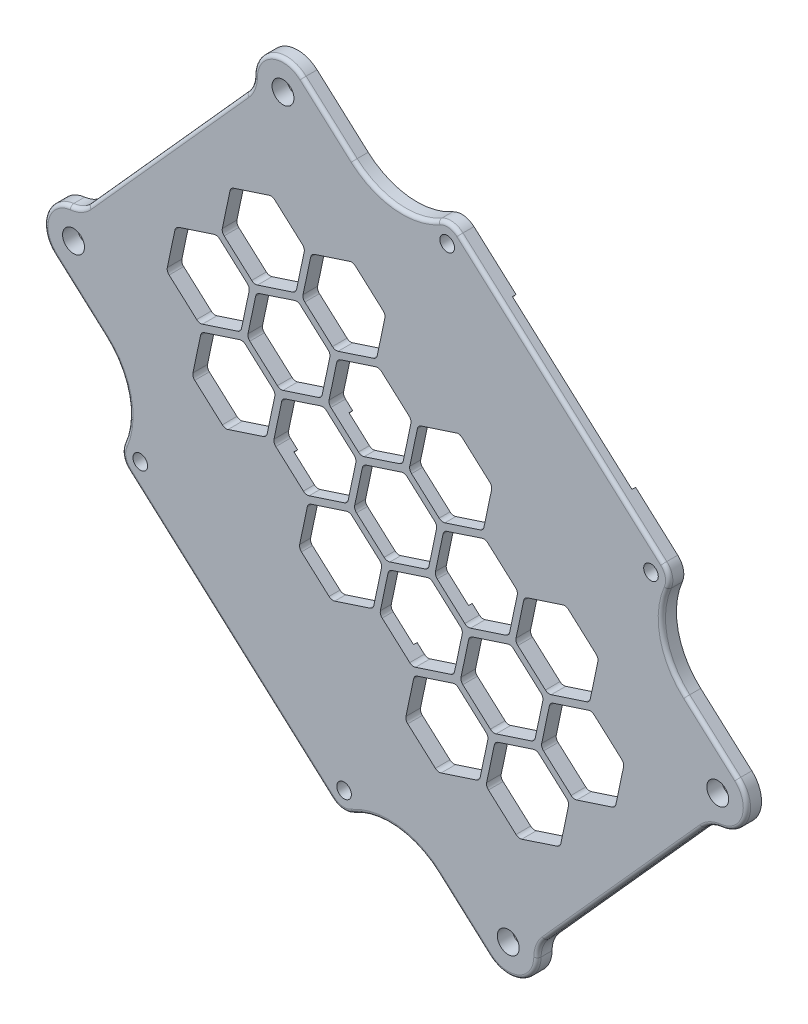
from build123d import *

# Parameters (mm, degrees)
SKETCH_1_R               = 1.5
SKETCH_1_R_2             = 1
EXTRUDE_1_DEPTH          = 2
CUT_EXTRUDE_1_DEPTH      = 170.147960134
CUT_EXTRUDE_1_DEPTH_BACK = 170.147960134
CUT_EXTRUDE_2_DEPTH      = 0.5
FILLET_1_R               = 0.5


with BuildPart() as part:
    # 草图1 → 凸台-拉伸1 (new body)
    with BuildSketch(Plane.XY):
        with BuildLine():
            Line((104.1666858, -4.873863482), (132.089438277, -29.905241673))
            ThreePointArc((132.089438277, -29.905241673), (132.861827092, -31.227500162), (132.718316168, -32.75208424))
            ThreePointArc((132.718316168, -32.75208424), (132.14427247, -38.850420549), (135.233827732, -44.139454506))
            Line((135.233827732, -44.139454506), (142.238552291, -50.418846543))
            ThreePointArc((142.238552291, -50.418846543), (143.562589272, -53.179192368), (142.546965548, -56.067287147))
            ThreePointArc((142.546965548, -56.067287147), (141.410609511, -56.94787551), (140.036310771, -57.369827968))
            ThreePointArc((140.036310771, -57.369827968), (138.66201203, -57.791780426), (137.525655994, -58.672368789))
            Line((137.525655994, -58.672368789), (115.887201179, -82.810281338))
            ThreePointArc((115.887201179, -82.810281338), (115.135572441, -84.035758856), (114.865759868, -85.447828996))
            ThreePointArc((114.865759868, -85.447828996), (114.595947294, -86.859899136), (113.844318556, -88.085376654))
            ThreePointArc((113.844318556, -88.085376654), (111.083972731, -89.409413635), (108.195877951, -88.393789911))
            Line((108.195877951, -88.393789911), (101.191153392, -82.114397874))
            ThreePointArc((101.191153392, -82.114397874), (95.597176576, -79.619071186), (89.597595338, -80.853679173))
            ThreePointArc((89.597595338, -80.853679173), (88.097700029, -81.16233117), (86.699205825, -80.538499498))
            Line((86.699205825, -80.538499498), (58.776453348, -55.507121307))
            ThreePointArc((58.776453348, -55.507121307), (58.004064533, -54.184862818), (58.147575457, -52.66027874))
            ThreePointArc((58.147575457, -52.66027874), (58.721619155, -46.561942431), (55.632063893, -41.272908475))
            Line((55.632063893, -41.272908475), (48.627339334, -34.993516437))
            ThreePointArc((48.627339334, -34.993516437), (47.303302353, -32.233170612), (48.318926077, -29.345075833))
            ThreePointArc((48.318926077, -29.345075833), (49.455282114, -28.46448747), (50.829580854, -28.042535012))
            ThreePointArc((50.829580854, -28.042535012), (52.203879595, -27.620582554), (53.340235631, -26.739994191))
            Line((53.340235631, -26.739994191), (74.978690446, -2.602081642))
            ThreePointArc((74.978690446, -2.602081642), (75.730319184, -1.376604124), (76.000131757, 0.035466016))
            ThreePointArc((76.000131757, 0.035466016), (76.269944331, 1.447536156), (77.021573069, 2.673013674))
            ThreePointArc((77.021573069, 2.673013674), (79.781918894, 3.997050655), (82.670013674, 2.981426931))
            Line((82.670013674, 2.981426931), (89.674738233, -3.297965106))
            ThreePointArc((89.674738233, -3.297965106), (95.268715049, -5.793291794), (101.268296287, -4.558683807))
            ThreePointArc((101.268296287, -4.558683807), (102.768191596, -4.25003181), (104.1666858, -4.873863482))
        make_face()
        with Locations((139.568538617, -53.397273473)):
            Circle(SKETCH_1_R, mode=Mode.SUBTRACT)
        with Locations((110.865891625, -85.41536298)):
            Circle(SKETCH_1_R, mode=Mode.SUBTRACT)
        with Locations((51.297353008, -32.015089507)):
            Circle(SKETCH_1_R, mode=Mode.SUBTRACT)
        with Locations((80, 0.003)):
            Circle(SKETCH_1_R, mode=Mode.SUBTRACT)
        with Locations((102.497927254, -6.735380314)):
            Circle(SKETCH_1_R_2, mode=Mode.SUBTRACT)
        with Locations((130.420679731, -31.766758505)):
            Circle(SKETCH_1_R_2, mode=Mode.SUBTRACT)
        with Locations((88.367964371, -78.676982666)):
            Circle(SKETCH_1_R_2, mode=Mode.SUBTRACT)
        with Locations((60.445211894, -53.645604475)):
            Circle(SKETCH_1_R_2, mode=Mode.SUBTRACT)
    extrude(amount=EXTRUDE_1_DEPTH)

    # 草图2 → 切除-拉伸1 (cut, two sides: drawn at the far end of the back side and taken through both)
    with BuildSketch(Plane.XY.offset(2).offset(-CUT_EXTRUDE_1_DEPTH_BACK)):
        with BuildLine():
            Line((99.995628017, -46.259205996), (101.040173707, -41.291597672))
            ThreePointArc((101.040173707, -41.291597672), (101.01759629, -40.878103121), (100.791296397, -40.531295044))
            Line((100.791296397, -40.531295044), (97.011494237, -37.142887779))
            ThreePointArc((97.011494237, -37.142887779), (96.642108743, -36.955693121), (96.228614193, -36.978270538))
            Line((96.228614193, -36.978270538), (91.404266343, -38.557471598))
            ThreePointArc((91.404266343, -38.557471598), (91.057458266, -38.78377149), (90.870263608, -39.153156984))
            Line((90.870263608, -39.153156984), (89.825717918, -44.120765309))
            ThreePointArc((89.825717918, -44.120765309), (89.848295335, -44.534259859), (90.074595228, -44.881067936))
            Line((90.074595228, -44.881067936), (93.854397388, -48.269475201))
            ThreePointArc((93.854397388, -48.269475201), (94.223782882, -48.456669859), (94.637277432, -48.434092442))
            Line((94.637277432, -48.434092442), (99.461625282, -46.854891382))
            ThreePointArc((99.461625282, -46.854891382), (99.808433359, -46.62859149), (99.995628017, -46.259205996))
        make_face()
        with BuildLine():
            Line((99.744006193, -47.717545146), (94.919658342, -49.296746205))
            ThreePointArc((94.919658342, -49.296746205), (94.572850266, -49.523046097), (94.385655608, -49.892431591))
            Line((94.385655608, -49.892431591), (93.341109918, -54.860039916))
            ThreePointArc((93.341109918, -54.860039916), (93.363687335, -55.273534466), (93.589987227, -55.620342543))
            Line((93.589987227, -55.620342543), (97.369789388, -59.008749808))
            ThreePointArc((97.369789388, -59.008749808), (97.739174881, -59.195944466), (98.152669432, -59.173367049))
            Line((98.152669432, -59.173367049), (102.977017282, -57.594165989))
            ThreePointArc((102.977017282, -57.594165989), (103.323825359, -57.367866097), (103.511020017, -56.998480603))
            Line((103.511020017, -56.998480603), (104.555565707, -52.030872279))
            ThreePointArc((104.555565707, -52.030872279), (104.532988289, -51.617377728), (104.306688397, -51.270569652))
            Line((104.306688397, -51.270569652), (100.526886237, -47.882162386))
            ThreePointArc((100.526886237, -47.882162386), (100.157500743, -47.694967728), (99.744006193, -47.717545146))
        make_face()
        with BuildLine():
            Line((101.132775856, -47.206286463), (104.912578016, -50.594693728))
            ThreePointArc((104.912578016, -50.594693728), (105.28196351, -50.781888387), (105.69545806, -50.759310969))
            Line((105.69545806, -50.759310969), (110.51980591, -49.18010991))
            ThreePointArc((110.51980591, -49.18010991), (110.866613987, -48.953810017), (111.053808645, -48.584424524))
            Line((111.053808645, -48.584424524), (112.098354335, -43.616816199))
            ThreePointArc((112.098354335, -43.616816199), (112.075776918, -43.203321648), (111.849477025, -42.856513572))
            Line((111.849477025, -42.856513572), (108.069674865, -39.468106307))
            ThreePointArc((108.069674865, -39.468106307), (107.700289371, -39.280911649), (107.286794821, -39.303489066))
            Line((107.286794821, -39.303489066), (102.462446971, -40.882690125))
            ThreePointArc((102.462446971, -40.882690125), (102.115638894, -41.108990018), (101.928444236, -41.478375511))
            Line((101.928444236, -41.478375511), (100.883898546, -46.445983836))
            ThreePointArc((100.883898546, -46.445983836), (100.906475963, -46.859478387), (101.132775856, -47.206286463))
        make_face()
        with BuildLine():
            Line((116.74570464, -53.134996247), (121.57005249, -51.555795187))
            ThreePointArc((121.57005249, -51.555795187), (121.916860566, -51.329495295), (122.104055225, -50.960109801))
            Line((122.104055225, -50.960109801), (123.148600915, -45.992501477))
            ThreePointArc((123.148600915, -45.992501477), (123.126023497, -45.579006926), (122.899723605, -45.232198849))
            Line((122.899723605, -45.232198849), (119.119921445, -41.843791584))
            ThreePointArc((119.119921445, -41.843791584), (118.750535951, -41.656596926), (118.3370414, -41.679174343))
            Line((118.3370414, -41.679174343), (113.51269355, -43.258375403))
            ThreePointArc((113.51269355, -43.258375403), (113.165885474, -43.484675295), (112.978690815, -43.854060789))
            Line((112.978690815, -43.854060789), (111.934145125, -48.821669114))
            ThreePointArc((111.934145125, -48.821669114), (111.956722543, -49.235163664), (112.183022435, -49.581971741))
            Line((112.183022435, -49.581971741), (115.962824595, -52.970379006))
            ThreePointArc((115.962824595, -52.970379006), (116.332210089, -53.157573664), (116.74570464, -53.134996247))
        make_face()
        with BuildLine():
            Line((102.18006606, -40.020036362), (107.00441391, -38.440835303))
            ThreePointArc((107.00441391, -38.440835303), (107.351221987, -38.21453541), (107.538416645, -37.845149916))
            Line((107.538416645, -37.845149916), (108.582962335, -32.877541592))
            ThreePointArc((108.582962335, -32.877541592), (108.560384918, -32.464047041), (108.334085025, -32.117238965))
            Line((108.334085025, -32.117238965), (104.554282865, -28.7288317))
            ThreePointArc((104.554282865, -28.7288317), (104.184897371, -28.541637041), (103.771402821, -28.564214459))
            Line((103.771402821, -28.564214459), (98.947054971, -30.143415518))
            ThreePointArc((98.947054971, -30.143415518), (98.600246894, -30.36971541), (98.413052236, -30.739100904))
            Line((98.413052236, -30.739100904), (97.368506546, -35.706709229))
            ThreePointArc((97.368506546, -35.706709229), (97.391083963, -36.120203779), (97.617383856, -36.467011856))
            Line((97.617383856, -36.467011856), (101.397186016, -39.855419121))
            ThreePointArc((101.397186016, -39.855419121), (101.76657151, -40.042613779), (102.18006606, -40.020036362))
        make_face()
        with BuildLine():
            Line((93.248507769, -48.945351124), (89.468705609, -45.556943859))
            ThreePointArc((89.468705609, -45.556943859), (89.099320115, -45.369749201), (88.685825565, -45.392326618))
            Line((88.685825565, -45.392326618), (83.861477714, -46.971527677))
            ThreePointArc((83.861477714, -46.971527677), (83.514669638, -47.19782757), (83.32747498, -47.567213064))
            Line((83.32747498, -47.567213064), (82.28292929, -52.534821388))
            ThreePointArc((82.28292929, -52.534821388), (82.305506707, -52.948315939), (82.5318066, -53.295124015))
            Line((82.5318066, -53.295124015), (86.31160876, -56.68353128))
            ThreePointArc((86.31160876, -56.68353128), (86.680994254, -56.870725939), (87.094488804, -56.848148521))
            Line((87.094488804, -56.848148521), (91.918836654, -55.268947462))
            ThreePointArc((91.918836654, -55.268947462), (92.265644731, -55.04264757), (92.452839389, -54.673262076))
            Line((92.452839389, -54.673262076), (93.497385079, -49.705653751))
            ThreePointArc((93.497385079, -49.705653751), (93.474807662, -49.292159201), (93.248507769, -48.945351124))
        make_face()
        with BuildLine():
            Line((115.698414435, -60.321246348), (119.478216595, -63.709653613))
            ThreePointArc((119.478216595, -63.709653613), (119.847602089, -63.896848271), (120.26109664, -63.874270854))
            Line((120.26109664, -63.874270854), (125.08544449, -62.295069794))
            ThreePointArc((125.08544449, -62.295069794), (125.432252566, -62.068769902), (125.619447224, -61.699384408))
            Line((125.619447224, -61.699384408), (126.663992914, -56.731776084))
            ThreePointArc((126.663992914, -56.731776084), (126.641415497, -56.318281533), (126.415115605, -55.971473457))
            Line((126.415115605, -55.971473457), (122.635313444, -52.583066191))
            ThreePointArc((122.635313444, -52.583066191), (122.265927951, -52.395871533), (121.8524334, -52.418448951))
            Line((121.8524334, -52.418448951), (117.02808555, -53.99765001))
            ThreePointArc((117.02808555, -53.99765001), (116.681277473, -54.223949902), (116.494082815, -54.593335396))
            Line((116.494082815, -54.593335396), (115.449537125, -59.560943721))
            ThreePointArc((115.449537125, -59.560943721), (115.472114543, -59.974438271), (115.698414435, -60.321246348))
        make_face()
        with BuildLine():
            Line((114.309644772, -60.83250503), (109.485296922, -62.41170609))
            ThreePointArc((109.485296922, -62.41170609), (109.138488845, -62.638005982), (108.951294187, -63.007391476))
            Line((108.951294187, -63.007391476), (107.906748497, -67.9749998))
            ThreePointArc((107.906748497, -67.9749998), (107.929325914, -68.388494351), (108.155625807, -68.735302427))
            Line((108.155625807, -68.735302427), (111.935427967, -72.123709693))
            ThreePointArc((111.935427967, -72.123709693), (112.304813461, -72.310904351), (112.718308011, -72.288326933))
            Line((112.718308011, -72.288326933), (117.542655861, -70.709125874))
            ThreePointArc((117.542655861, -70.709125874), (117.889463938, -70.482825982), (118.076658596, -70.113440488))
            Line((118.076658596, -70.113440488), (119.121204286, -65.145832163))
            ThreePointArc((119.121204286, -65.145832163), (119.098626869, -64.732337613), (118.872326976, -64.385529536))
            Line((118.872326976, -64.385529536), (115.092524816, -60.997122271))
            ThreePointArc((115.092524816, -60.997122271), (114.723139322, -60.809927613), (114.309644772, -60.83250503))
        make_face()
        with BuildLine():
            Line((114.561266596, -59.374165881), (115.605812286, -54.406557556))
            ThreePointArc((115.605812286, -54.406557556), (115.583234869, -53.993063006), (115.356934977, -53.646254929))
            Line((115.356934977, -53.646254929), (111.577132817, -50.257847664))
            ThreePointArc((111.577132817, -50.257847664), (111.207747323, -50.070653006), (110.794252772, -50.093230423))
            Line((110.794252772, -50.093230423), (105.969904922, -51.672431482))
            ThreePointArc((105.969904922, -51.672431482), (105.623096846, -51.898731375), (105.435902187, -52.268116869))
            Line((105.435902187, -52.268116869), (104.391356497, -57.235725193))
            ThreePointArc((104.391356497, -57.235725193), (104.413933915, -57.649219744), (104.640233807, -57.99602782))
            Line((104.640233807, -57.99602782), (108.420035967, -61.384435085))
            ThreePointArc((108.420035967, -61.384435085), (108.789421461, -61.571629744), (109.202916012, -61.549052326))
            Line((109.202916012, -61.549052326), (114.027263862, -59.969851267))
            ThreePointArc((114.027263862, -59.969851267), (114.374071938, -59.743551375), (114.561266596, -59.374165881))
        make_face()
        with BuildLine():
            Line((107.814146349, -62.060311009), (104.034344188, -58.671903744))
            ThreePointArc((104.034344188, -58.671903744), (103.664958695, -58.484709085), (103.251464144, -58.507286503))
            Line((103.251464144, -58.507286503), (98.427116294, -60.086487562))
            ThreePointArc((98.427116294, -60.086487562), (98.080308217, -60.312787454), (97.893113559, -60.682172948))
            Line((97.893113559, -60.682172948), (96.848567869, -65.649781273))
            ThreePointArc((96.848567869, -65.649781273), (96.871145287, -66.063275823), (97.097445179, -66.4100839))
            Line((97.097445179, -66.4100839), (100.877247339, -69.798491165))
            ThreePointArc((100.877247339, -69.798491165), (101.246632833, -69.985685823), (101.660127383, -69.963108406))
            Line((101.660127383, -69.963108406), (106.484475234, -68.383907347))
            ThreePointArc((106.484475234, -68.383907347), (106.83128331, -68.157607454), (107.018477968, -67.78822196))
            Line((107.018477968, -67.78822196), (108.063023658, -62.820613636))
            ThreePointArc((108.063023658, -62.820613636), (108.040446241, -62.407119085), (107.814146349, -62.060311009))
        make_face()
        with BuildLine():
            Line((95.946233283, -36.115616775), (91.121885432, -37.694817835))
            ThreePointArc((91.121885432, -37.694817835), (90.708390882, -37.717395252), (90.339005388, -37.530200594))
            Line((90.339005388, -37.530200594), (86.559203228, -34.141793328))
            ThreePointArc((86.559203228, -34.141793328), (86.332903336, -33.794985252), (86.310325918, -33.381490701))
            Line((86.310325918, -33.381490701), (87.354871608, -28.413882377))
            ThreePointArc((87.354871608, -28.413882377), (87.542066266, -28.044496883), (87.888874343, -27.818196991))
            Line((87.888874343, -27.818196991), (92.713222193, -26.238995931))
            ThreePointArc((92.713222193, -26.238995931), (93.126716744, -26.216418514), (93.496102237, -26.403613172))
            Line((93.496102237, -26.403613172), (97.275904398, -29.792020437))
            ThreePointArc((97.275904398, -29.792020437), (97.50220429, -30.138828514), (97.524781707, -30.552323064))
            Line((97.524781707, -30.552323064), (96.480236017, -35.519931389))
            ThreePointArc((96.480236017, -35.519931389), (96.293041359, -35.889316883), (95.946233283, -36.115616775))
        make_face()
        with BuildLine():
            Line((85.953313609, -34.817669252), (89.733115769, -38.206076517))
            ThreePointArc((89.733115769, -38.206076517), (89.959415662, -38.552884593), (89.981993079, -38.966379144))
            Line((89.981993079, -38.966379144), (88.937447389, -43.933987469))
            ThreePointArc((88.937447389, -43.933987469), (88.750252731, -44.303372962), (88.403444654, -44.529672855))
            Line((88.403444654, -44.529672855), (83.579096804, -46.108873914))
            ThreePointArc((83.579096804, -46.108873914), (83.165602254, -46.131451332), (82.79621676, -45.944256673))
            Line((82.79621676, -45.944256673), (79.0164146, -42.555849408))
            ThreePointArc((79.0164146, -42.555849408), (78.790114707, -42.209041332), (78.76753729, -41.795546781))
            Line((78.76753729, -41.795546781), (79.81208298, -36.827938456))
            ThreePointArc((79.81208298, -36.827938456), (79.999277638, -36.458552963), (80.346085715, -36.23225307))
            Line((80.346085715, -36.23225307), (85.170433565, -34.653052011))
            ThreePointArc((85.170433565, -34.653052011), (85.583928115, -34.630474593), (85.953313609, -34.817669252))
        make_face()
        with BuildLine():
            Line((69.238602204, -33.920416161), (74.062950054, -32.341215102))
            ThreePointArc((74.062950054, -32.341215102), (74.476444605, -32.318637685), (74.845830099, -32.505832343))
            Line((74.845830099, -32.505832343), (78.625632259, -35.894239608))
            ThreePointArc((78.625632259, -35.894239608), (78.851932151, -36.241047685), (78.874509568, -36.654542235))
            Line((78.874509568, -36.654542235), (77.829963878, -41.62215056))
            ThreePointArc((77.829963878, -41.62215056), (77.64276922, -41.991536054), (77.295961144, -42.217835946))
            Line((77.295961144, -42.217835946), (72.471613294, -43.797037005))
            ThreePointArc((72.471613294, -43.797037005), (72.058118743, -43.819614423), (71.688733249, -43.632419764))
            Line((71.688733249, -43.632419764), (67.908931089, -40.244012499))
            ThreePointArc((67.908931089, -40.244012499), (67.682631197, -39.897204423), (67.660053779, -39.483709872))
            Line((67.660053779, -39.483709872), (68.704599469, -34.516101548))
            ThreePointArc((68.704599469, -34.516101548), (68.891794128, -34.146716054), (69.238602204, -33.920416161))
        make_face()
        with BuildLine():
            Line((86.774310505, -26.804307605), (82.994508345, -23.41590034))
            ThreePointArc((82.994508345, -23.41590034), (82.768208453, -23.069092263), (82.745631036, -22.655597713))
            Line((82.745631036, -22.655597713), (83.790176725, -17.687989388))
            ThreePointArc((83.790176725, -17.687989388), (83.977371384, -17.318603894), (84.32417946, -17.092304002))
            Line((84.32417946, -17.092304002), (89.14852731, -15.513102943))
            ThreePointArc((89.14852731, -15.513102943), (89.562021861, -15.490525525), (89.931407355, -15.677720184))
            Line((89.931407355, -15.677720184), (93.711209515, -19.066127449))
            ThreePointArc((93.711209515, -19.066127449), (93.937509407, -19.412935525), (93.960086825, -19.826430076))
            Line((93.960086825, -19.826430076), (92.915541135, -24.7940384))
            ThreePointArc((92.915541135, -24.7940384), (92.728346476, -25.163423894), (92.3815384, -25.389723787))
            Line((92.3815384, -25.389723787), (87.55719055, -26.968924846))
            ThreePointArc((87.55719055, -26.968924846), (87.143695999, -26.991502263), (86.774310505, -26.804307605))
        make_face()
        with BuildLine():
            Line((75.202842407, -31.069653792), (76.247388097, -26.102045468))
            ThreePointArc((76.247388097, -26.102045468), (76.434582756, -25.732659974), (76.781390832, -25.506360082))
            Line((76.781390832, -25.506360082), (81.605738682, -23.927159022))
            ThreePointArc((81.605738682, -23.927159022), (82.019233233, -23.904581605), (82.388618727, -24.091776263))
            Line((82.388618727, -24.091776263), (86.168420887, -27.480183528))
            ThreePointArc((86.168420887, -27.480183528), (86.394720779, -27.826991605), (86.417298197, -28.240486156))
            Line((86.417298197, -28.240486156), (85.372752507, -33.20809448))
            ThreePointArc((85.372752507, -33.20809448), (85.185557848, -33.577479974), (84.838749772, -33.803779866))
            Line((84.838749772, -33.803779866), (80.014401922, -35.382980926))
            ThreePointArc((80.014401922, -35.382980926), (79.600907371, -35.405558343), (79.231521877, -35.218363685))
            Line((79.231521877, -35.218363685), (75.451719717, -31.82995642))
            ThreePointArc((75.451719717, -31.82995642), (75.225419825, -31.483148343), (75.202842407, -31.069653792))
        make_face()
        with BuildLine():
            Line((71.330438099, -21.766557736), (75.110240259, -25.154965001))
            ThreePointArc((75.110240259, -25.154965001), (75.336540151, -25.501773077), (75.359117569, -25.915267628))
            Line((75.359117569, -25.915267628), (74.314571879, -30.882875953))
            ThreePointArc((74.314571879, -30.882875953), (74.12737722, -31.252261446), (73.780569144, -31.478561339))
            Line((73.780569144, -31.478561339), (68.956221294, -33.057762398))
            ThreePointArc((68.956221294, -33.057762398), (68.542726743, -33.080339816), (68.173341249, -32.893145157))
            Line((68.173341249, -32.893145157), (64.393539089, -29.504737892))
            ThreePointArc((64.393539089, -29.504737892), (64.167239197, -29.157929816), (64.144661779, -28.744435265))
            Line((64.144661779, -28.744435265), (65.189207469, -23.77682694))
            ThreePointArc((65.189207469, -23.77682694), (65.376402128, -23.407441447), (65.723210204, -23.181141554))
            Line((65.723210204, -23.181141554), (70.547558054, -21.601940495))
            ThreePointArc((70.547558054, -21.601940495), (70.961052605, -21.579363077), (71.330438099, -21.766557736))
        make_face()
        with BuildLine():
            Line((81.323357772, -23.064505259), (76.499009922, -24.643706318))
            ThreePointArc((76.499009922, -24.643706318), (76.085515371, -24.666283736), (75.716129877, -24.479089078))
            Line((75.716129877, -24.479089078), (71.936327717, -21.090681812))
            ThreePointArc((71.936327717, -21.090681812), (71.710027825, -20.743873736), (71.687450408, -20.330379185))
            Line((71.687450408, -20.330379185), (72.731996098, -15.362770861))
            ThreePointArc((72.731996098, -15.362770861), (72.919190756, -14.993385367), (73.265998832, -14.767085475))
            Line((73.265998832, -14.767085475), (78.090346682, -13.187884415))
            ThreePointArc((78.090346682, -13.187884415), (78.503841233, -13.165306998), (78.873226727, -13.352501656))
            Line((78.873226727, -13.352501656), (82.653028887, -16.740908921))
            ThreePointArc((82.653028887, -16.740908921), (82.879328779, -17.087716998), (82.901906197, -17.501211548))
            Line((82.901906197, -17.501211548), (81.857360507, -22.468819873))
            ThreePointArc((81.857360507, -22.468819873), (81.670165849, -22.838205367), (81.323357772, -23.064505259))
        make_face()
    extrude(amount=CUT_EXTRUDE_1_DEPTH + CUT_EXTRUDE_1_DEPTH_BACK, mode=Mode.SUBTRACT)

    # 草图3 → 切除-拉伸2 (cut)
    with BuildSketch(Plane(origin=(0, 0, 0), x_dir=(-1, 0, 0), z_dir=(0, 0, -1))):
        Polygon((-126.318736099, -24.73209018), (-80.928503646, -75.365348005), (-64.547155526, -60.6802728), (-109.937387979, -10.047014975), align=None)
    extrude(amount=-CUT_EXTRUDE_2_DEPTH, mode=Mode.SUBTRACT)

    # 圆角1
    fillet_1_edges = [part.edges().sort_by_distance(p)[0] for p in [
        (75.730319184, -1.376604124, 2),
        (64.159463039, -14.671037916, 2),
        (52.203879595, -27.620582554, 2),
        (52.129701614, -38.133212456, 2),
        (58.721619155, -46.561942431, 2),
        (58.004064533, -54.184862818, 2),
        (72.737829586, -68.022810402, 2),
        (88.097700029, -81.16233117, 2),
        (95.597176576, -79.619071186, 2),
        (104.693515672, -85.254093892, 2),
        (112.481997971, -89.074351949, 2),
        (115.135572441, -84.035758856, 2),
        (47.48415741, -30.80697555, 2),
        (126.706428586, -70.741325064, 2),
        (138.66201203, -57.791780426, 2),
        (143.381734215, -54.60538743, 2),
        (138.736190011, -47.279150524, 2),
        (132.14427247, -38.850420549, 2),
        (132.861827092, -31.227500162, 2),
        (118.128062039, -17.389552578, 2),
        (102.768191596, -4.25003181, 2),
        (95.268715049, -5.793291794, 2),
        (86.172375953, -0.158269088, 2),
        (78.383893654, 3.661988969, 2),
    ]]
    fillet(fillet_1_edges, radius=FILLET_1_R)


solid = part.part
